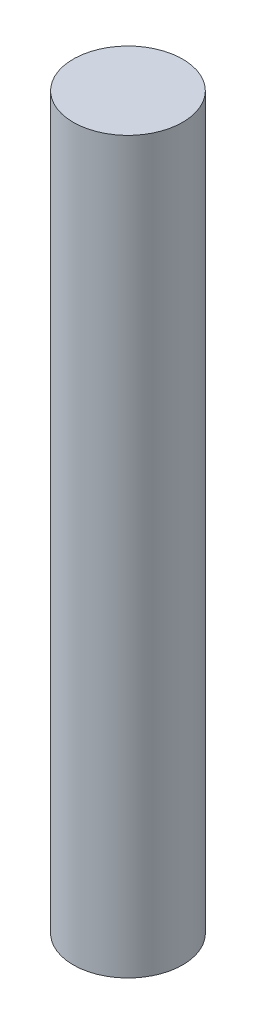
from build123d import *

# Parameters (mm, degrees)
SKETCH1_R           = 1.5
BOSS_EXTRUDE1_DEPTH = 20


with BuildPart() as part:
    # Sketch1 → Boss-Extrude1 (new body)
    with BuildSketch(Plane(origin=(0, 0, 0), x_dir=(1, 0, 0), z_dir=(0, 1, 0))):
        with Locations(Location((0, 0, 0), (0, 0, 270))):
            Circle(SKETCH1_R)
    extrude(amount=BOSS_EXTRUDE1_DEPTH)


solid = part.part
